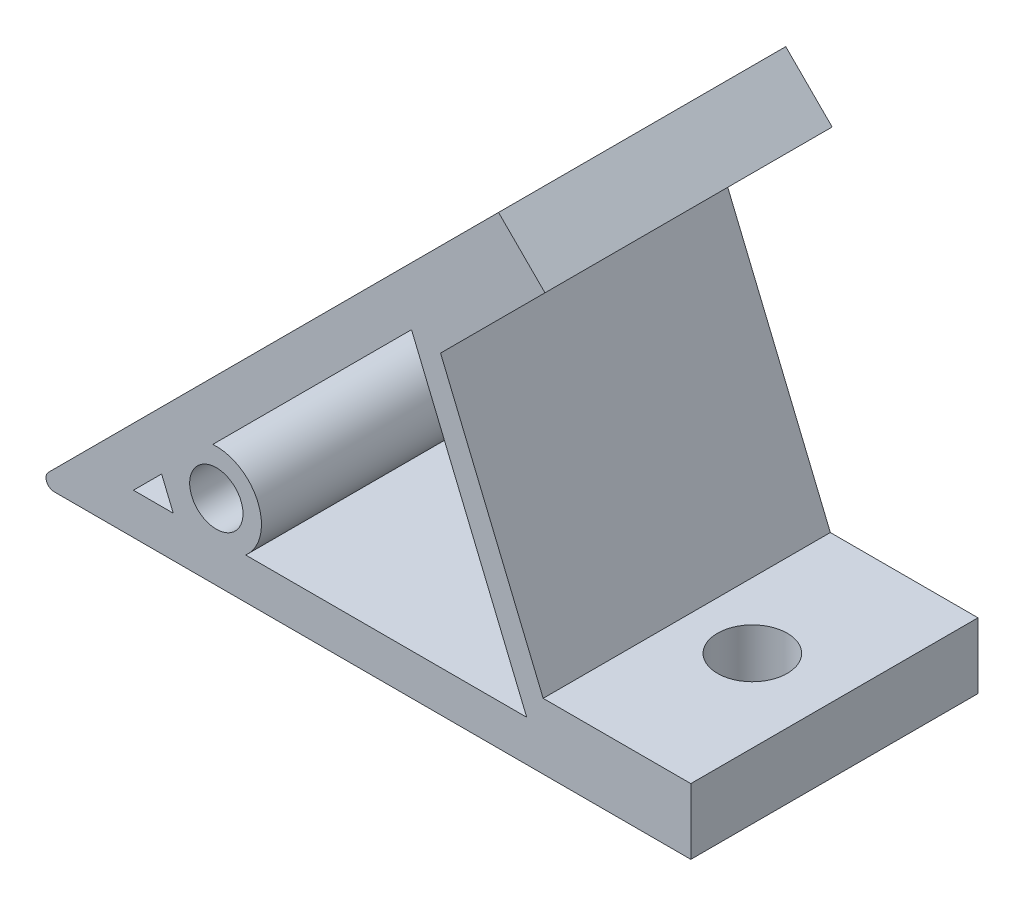
from build123d import *

# Parameters (mm, degrees)
SKETCH_1_R          = 3.25
EXTRUDE_1_DEPTH     = 17.5
SKETCH_3_R          = 4.25
CUT_EXTRUDE_1_DEPTH = 17


with BuildPart() as part:
    # 草图1 → 凸台-拉伸1 (new, symmetric)
    with BuildSketch(Plane.XY):
        with BuildLine():
            Line((-77.585786438, 0), (0, 0))
            Line((0, 0), (0, 8))
            Line((0, 8), (-17.995464086, 8))
            Line((-17.995464086, 8), (-30.499317942, 38.186973559))
            Line((-30.499317942, 38.186973559), (-17.774603256, 50.911688245))
            Line((-17.774603256, 50.911688245), (-23.431457505, 56.568542495))
            Line((-23.431457505, 56.568542495), (-78.292893219, 1.707106781))
            ThreePointArc((-78.292893219, 1.707106781), (-78.50966597, 0.617316568), (-77.585786438, 0))
        make_face()
        with Locations((-57.82689122, 9.184402377)):
            Circle(SKETCH_1_R, mode=Mode.SUBTRACT)
        Polygon((-67.928932188, 5), (-63.07447047, 5), (-64.496309389, 8.4326228), align=None, mode=Mode.SUBTRACT)
        with BuildLine():
            Line((-54.257468753, 5), (-20, 5))
            Line((-20, 5), (-34.038059223, 38.890872965))
            Line((-34.038059223, 38.890872965), (-58.261747684, 14.667184504))
            ThreePointArc((-58.261747684, 14.667184504), (-52.745553791, 11.289161255), (-54.257468753, 5))
        make_face(mode=Mode.SUBTRACT)
    extrude(amount=EXTRUDE_1_DEPTH, both=True)

    # 草图3 → 切除-拉伸1 (cut)
    with BuildSketch(Plane(origin=(0, 8, 0), x_dir=(1, 0, 0), z_dir=(0, 1, 0))):
        with Locations(Location((-10, 0, 0), (0, 0, 180))):
            Circle(SKETCH_3_R)
    cut_extrude_1 = extrude(amount=-CUT_EXTRUDE_1_DEPTH, mode=Mode.SUBTRACT)

    # 镜向1: 切除-拉伸1 across plane
    add(cut_extrude_1.mirror(Plane(origin=(-11.715728753, 28.284271247, 0), x_dir=(0, 0, 1), z_dir=(-0.3826834323650881, 0.9238795325112875, 0))), mode=Mode.SUBTRACT)


solid = part.part
